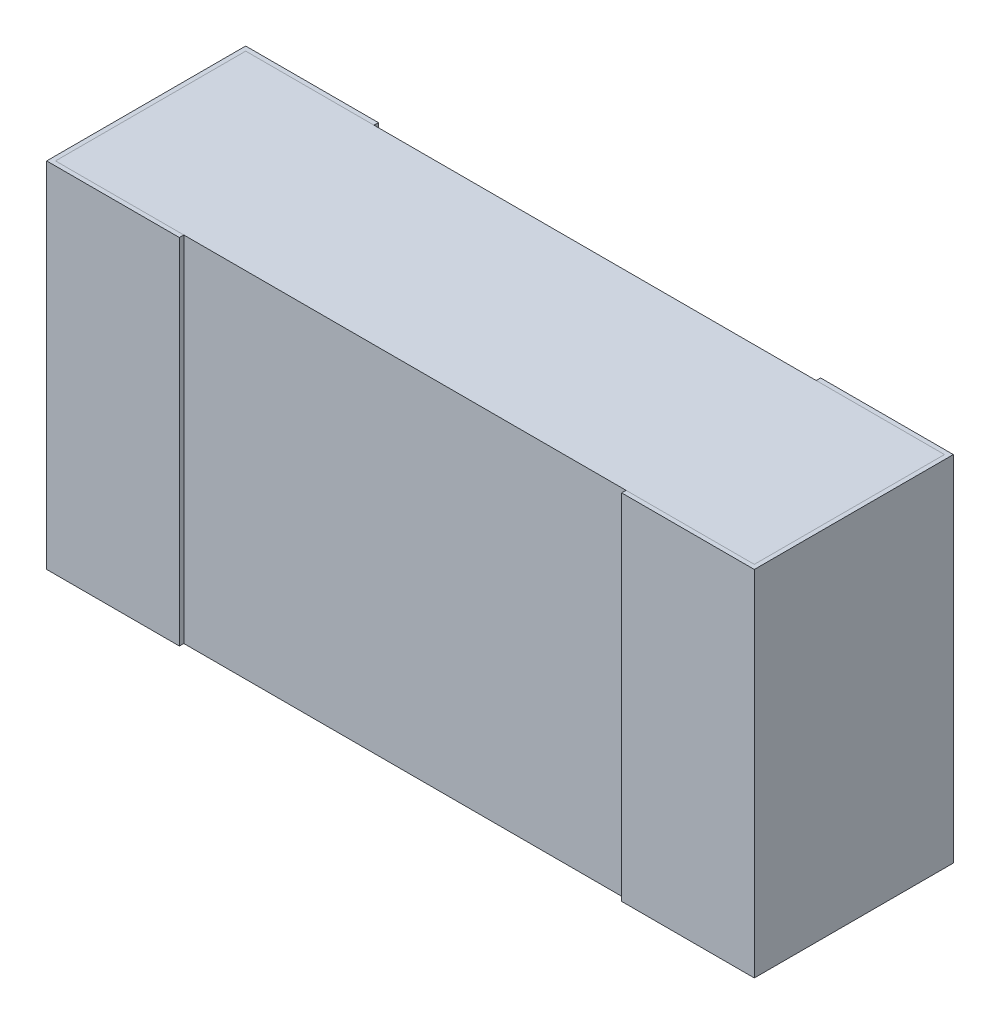
from build123d import *

# Parameters (mm, degrees)
BOSS_EXTRUDE2_DEPTH   = 0.4
BOSS_EXTRUDE2_2_DEPTH = 0.4
BOSS_EXTRUDE3_START   = -0.4
SKETCH5_W             = 0.43
SKETCH5_H             = 1.58
BOSS_EXTRUDE3_DEPTH   = 0.8


with BuildPart() as part:
    # Sketch4 → Boss-Extrude2 (new, symmetric)
    with BuildSketch(Plane(origin=(0, 0, 0), x_dir=(-1, 0, 0), z_dir=(0, 1, 0))):
        Polygon((-0.8, -0.011612161), (-0.8, -0.461612161), (-0.5, -0.461612161), (-0.5, -0.451612161), (-0.79, -0.451612161), (-0.79, -0.021612161), (-0.5, -0.021612161), (-0.5, -0.011612161), align=None)
    extrude(amount=BOSS_EXTRUDE2_DEPTH, both=True)


with BuildPart() as body_2:
    # Sketch4 → Boss-Extrude2 2 (new, symmetric)
    with BuildSketch(Plane(origin=(0, 0, 0), x_dir=(-1, 0, 0), z_dir=(0, 1, 0))):
        Polygon((0.5, -0.011612161), (0.8, -0.011612161), (0.8, -0.461612161), (0.5, -0.461612161), (0.5, -0.451612161), (0.79, -0.451612161), (0.79, -0.021612161), (0.5, -0.021612161), align=None)
    extrude(amount=BOSS_EXTRUDE2_2_DEPTH, both=True)


with BuildPart() as body_3:
    # Sketch5 → Boss-Extrude3 (new body)
    with BuildSketch(Plane(origin=(0, 0, 0), x_dir=(0, 0, -1), z_dir=(0, 1, 0)).offset(BOSS_EXTRUDE3_START)):
        with Locations((0.236612161, 0)):
            Rectangle(SKETCH5_W, SKETCH5_H)
    extrude(amount=BOSS_EXTRUDE3_DEPTH)


solid = Compound([part.part, body_2.part, body_3.part])
